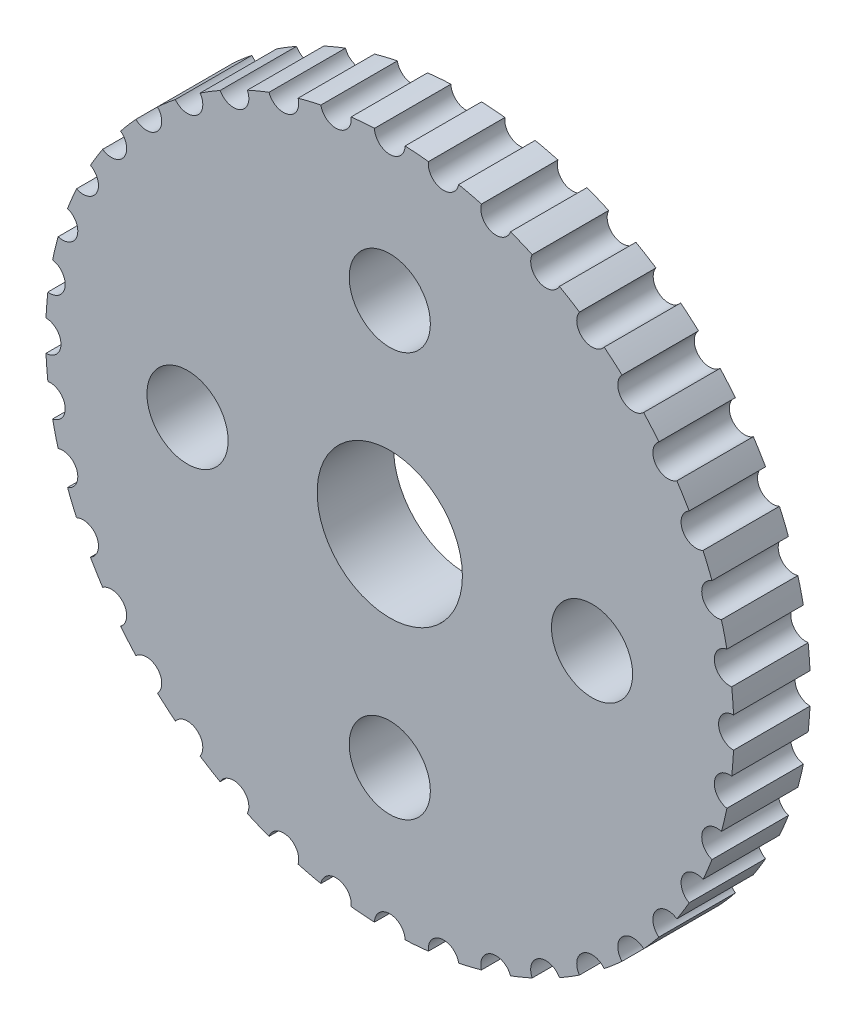
from build123d import *

# Parameters (mm, degrees)
SKETCH_8_R      = 5.308589755
SKETCH_8_R_2    = 9.5
EXTRUDE_1_DEPTH = 10


with BuildPart() as part:
    # 草图8 → 凸台-拉伸1 (new body)
    with BuildSketch(Plane.XY):
        with BuildLine():
            ThreePointArc((44.955555556, -1.999506112), (43, 0), (44.955555556, 1.999506112))
            ThreePointArc((44.955555556, 1.999506112), (44.861280018, 3.530659308), (44.714869736, 5.05770941))
            ThreePointArc((44.714869736, 5.05770941), (42.470598646, 6.726681997), (44.089286398, 9.007487158))
            ThreePointArc((44.089286398, 9.007487158), (43.756646418, 10.505041374), (43.373155424, 11.990387341))
            ThreePointArc((43.373155424, 11.990387341), (40.895430201, 13.287730758), (42.137392686, 15.793673975))
            ThreePointArc((42.137392686, 15.793673975), (41.574578963, 17.220754456), (40.963450077, 18.627822142))
            ThreePointArc((40.963450077, 18.627822142), (38.31328054, 19.521591489), (39.14793652, 22.190968124))
            ThreePointArc((39.14793652, 22.190968124), (38.368807396, 23.512435412), (37.54508864, 24.806578139))
            ThreePointArc((37.54508864, 24.806578139), (34.787730758, 25.274765849), (35.194528232, 28.041846989))
            ThreePointArc((35.194528232, 28.041846989), (34.218268452, 29.225162175), (33.202242516, 30.374513855))
            ThreePointArc((33.202242516, 30.374513855), (30.405591591, 30.405591591), (30.374513855, 33.202242516))
            ThreePointArc((30.374513855, 33.202242516), (29.225162175, 34.218268452), (28.041846989, 35.194528232))
            ThreePointArc((28.041846989, 35.194528232), (25.274765849, 34.787730758), (24.806578139, 37.54508864))
            ThreePointArc((24.806578139, 37.54508864), (23.512435412, 38.368807396), (22.190968124, 39.14793652))
            ThreePointArc((22.190968124, 39.14793652), (19.521591489, 38.31328054), (18.627822142, 40.963450077))
            ThreePointArc((18.627822142, 40.963450077), (17.220754456, 41.574578963), (15.793673975, 42.137392686))
            ThreePointArc((15.793673975, 42.137392686), (13.287730758, 40.895430201), (11.990387341, 43.373155424))
            ThreePointArc((11.990387341, 43.373155424), (10.505041374, 43.756646418), (9.007487158, 44.089286398))
            ThreePointArc((9.007487158, 44.089286398), (6.726681997, 42.470598646), (5.05770941, 44.714869736))
            ThreePointArc((5.05770941, 44.714869736), (3.530659308, 44.861280018), (1.999506112, 44.955555556))
            ThreePointArc((1.999506112, 44.955555556), (0, 43), (-1.999506112, 44.955555556))
            ThreePointArc((-1.999506112, 44.955555556), (-3.530659308, 44.861280018), (-5.05770941, 44.714869736))
            ThreePointArc((-5.05770941, 44.714869736), (-5.044095711, 44.580728744), (-5.039550927, 44.445975327))
            ThreePointArc((-5.039550927, 44.445975327), (-6.860487337, 42.454007398), (-9.007487158, 44.089286398))
            ThreePointArc((-9.007487158, 44.089286398), (-10.505041374, 43.756646418), (-11.990387341, 43.373155424))
            ThreePointArc((-11.990387341, 43.373155424), (-11.927033485, 43.088442863), (-11.905764747, 42.797543233))
            ThreePointArc((-11.905764747, 42.797543233), (-13.570965148, 40.825765044), (-15.793673975, 42.137392686))
            ThreePointArc((-15.793673975, 42.137392686), (-17.220754456, 41.574578963), (-18.627822142, 40.963450077))
            ThreePointArc((-18.627822142, 40.963450077), (-18.479764717, 40.540545937), (-18.429572488, 40.095293588))
            ThreePointArc((-18.429572488, 40.095293588), (-19.941101031, 38.155861807), (-22.190968124, 39.14793652))
            ThreePointArc((-22.190968124, 39.14793652), (-23.512435412, 38.368807396), (-24.806578139, 37.54508864))
            ThreePointArc((-24.806578139, 37.54508864), (-24.541473285, 37.002624685), (-24.450336353, 36.405764747))
            ThreePointArc((-24.450336353, 36.405764747), (-25.811204626, 34.510636615), (-28.041846989, 35.194528232))
            ThreePointArc((-28.041846989, 35.194528232), (-29.225162175, 34.218268452), (-30.374513855, 33.202242516))
            ThreePointArc((-30.374513855, 33.202242516), (-29.963655564, 32.564592842), (-29.819805153, 31.819805153))
            ThreePointArc((-29.819805153, 31.819805153), (-31.033953617, 29.980664767), (-33.202242516, 30.374513855))
            ThreePointArc((-33.202242516, 30.374513855), (-34.218268452, 29.225162175), (-35.194528232, 28.041846989))
            ThreePointArc((-35.194528232, 28.041846989), (-34.613772416, 27.338459928), (-34.405764747, 26.450336353))
            ThreePointArc((-34.405764747, 26.450336353), (-35.478038437, 24.678522623), (-37.54508864, 24.806578139))
            ThreePointArc((-37.54508864, 24.806578139), (-38.368807396, 23.512435412), (-39.14793652, 22.190968124))
            ThreePointArc((-39.14793652, 22.190968124), (-38.378506744, 21.455556373), (-38.095293588, 20.429572488))
            ThreePointArc((-38.095293588, 20.429572488), (-39.031412246, 18.736009236), (-40.963450077, 18.627822142))
            ThreePointArc((-40.963450077, 18.627822142), (-41.574578963, 17.220754456), (-42.137392686, 15.793673975))
            ThreePointArc((-42.137392686, 15.793673975), (-41.166546438, 15.063283409), (-40.797543233, 13.905764747))
            ThreePointArc((-40.797543233, 13.905764747), (-41.604066041, 12.300893353), (-43.373155424, 11.990387341))
            ThreePointArc((-43.373155424, 11.990387341), (-43.756646418, 10.505041374), (-44.089286398, 9.007487158))
            ThreePointArc((-44.089286398, 9.007487158), (-42.910824217, 8.321467879), (-42.445975327, 7.039550927))
            ThreePointArc((-42.445975327, 7.039550927), (-43.130260468, 5.533265957), (-44.714869736, 5.05770941))
            ThreePointArc((-44.714869736, 5.05770941), (-44.861280018, 3.530659308), (-44.955555556, 1.999506112))
            ThreePointArc((-44.955555556, 1.999506112), (-43.570159294, 1.398411798), (-43, 0))
            ThreePointArc((-43, 0), (-43.570159294, -1.398411798), (-44.955555556, -1.999506112))
            ThreePointArc((-44.955555556, -1.999506112), (-44.861280018, -3.530659308), (-44.714869736, -5.05770941))
            ThreePointArc((-44.714869736, -5.05770941), (-43.130260468, -5.533265957), (-42.445975327, -7.039550927))
            ThreePointArc((-42.445975327, -7.039550927), (-42.910824217, -8.321467879), (-44.089286398, -9.007487158))
            ThreePointArc((-44.089286398, -9.007487158), (-43.756646418, -10.505041374), (-43.373155424, -11.990387341))
            ThreePointArc((-43.373155424, -11.990387341), (-41.604066041, -12.300893353), (-40.797543233, -13.905764747))
            ThreePointArc((-40.797543233, -13.905764747), (-41.166546438, -15.063283409), (-42.137392686, -15.793673975))
            ThreePointArc((-42.137392686, -15.793673975), (-41.574578963, -17.220754456), (-40.963450077, -18.627822142))
            ThreePointArc((-40.963450077, -18.627822142), (-39.031412246, -18.736009236), (-38.095293588, -20.429572488))
            ThreePointArc((-38.095293588, -20.429572488), (-38.378506744, -21.455556373), (-39.14793652, -22.190968124))
            ThreePointArc((-39.14793652, -22.190968124), (-38.368807396, -23.512435412), (-37.54508864, -24.806578139))
            ThreePointArc((-37.54508864, -24.806578139), (-35.478038437, -24.678522623), (-34.405764747, -26.450336353))
            ThreePointArc((-34.405764747, -26.450336353), (-34.613772416, -27.338459928), (-35.194528232, -28.041846989))
            ThreePointArc((-35.194528232, -28.041846989), (-34.218268452, -29.225162175), (-33.202242516, -30.374513855))
            ThreePointArc((-33.202242516, -30.374513855), (-31.033953617, -29.980664767), (-29.819805153, -31.819805153))
            ThreePointArc((-29.819805153, -31.819805153), (-29.963655564, -32.564592842), (-30.374513855, -33.202242516))
            ThreePointArc((-30.374513855, -33.202242516), (-29.225162175, -34.218268452), (-28.041846989, -35.194528232))
            ThreePointArc((-28.041846989, -35.194528232), (-25.811204626, -34.510636615), (-24.450336353, -36.405764747))
            ThreePointArc((-24.450336353, -36.405764747), (-24.541473285, -37.002624685), (-24.806578139, -37.54508864))
            ThreePointArc((-24.806578139, -37.54508864), (-23.512435412, -38.368807396), (-22.190968124, -39.14793652))
            ThreePointArc((-22.190968124, -39.14793652), (-19.941101031, -38.155861807), (-18.429572488, -40.095293588))
            ThreePointArc((-18.429572488, -40.095293588), (-18.479764717, -40.540545937), (-18.627822142, -40.963450077))
            ThreePointArc((-18.627822142, -40.963450077), (-17.220754456, -41.574578963), (-15.793673975, -42.137392686))
            ThreePointArc((-15.793673975, -42.137392686), (-13.570965148, -40.825765044), (-11.905764747, -42.797543233))
            ThreePointArc((-11.905764747, -42.797543233), (-11.927033485, -43.088442863), (-11.990387341, -43.373155424))
            ThreePointArc((-11.990387341, -43.373155424), (-10.505041374, -43.756646418), (-9.007487158, -44.089286398))
            ThreePointArc((-9.007487158, -44.089286398), (-6.860487337, -42.454007398), (-5.039550927, -44.445975327))
            ThreePointArc((-5.039550927, -44.445975327), (-5.044095711, -44.580728744), (-5.05770941, -44.714869736))
            ThreePointArc((-5.05770941, -44.714869736), (-3.530659308, -44.861280018), (-1.999506112, -44.955555556))
            ThreePointArc((-1.999506112, -44.955555556), (0, -43), (1.999506112, -44.955555556))
            ThreePointArc((1.999506112, -44.955555556), (3.530659308, -44.861280018), (5.05770941, -44.714869736))
            ThreePointArc((5.05770941, -44.714869736), (6.726681997, -42.470598646), (9.007487158, -44.089286398))
            ThreePointArc((9.007487158, -44.089286398), (10.505041374, -43.756646418), (11.990387341, -43.373155424))
            ThreePointArc((11.990387341, -43.373155424), (13.287730758, -40.895430201), (15.793673975, -42.137392686))
            ThreePointArc((15.793673975, -42.137392686), (17.220754456, -41.574578963), (18.627822142, -40.963450077))
            ThreePointArc((18.627822142, -40.963450077), (19.521591489, -38.31328054), (22.190968124, -39.14793652))
            ThreePointArc((22.190968124, -39.14793652), (23.512435412, -38.368807396), (24.806578139, -37.54508864))
            ThreePointArc((24.806578139, -37.54508864), (25.274765849, -34.787730758), (28.041846989, -35.194528232))
            ThreePointArc((28.041846989, -35.194528232), (29.225162175, -34.218268452), (30.374513855, -33.202242516))
            ThreePointArc((30.374513855, -33.202242516), (30.405591591, -30.405591591), (33.202242516, -30.374513855))
            ThreePointArc((33.202242516, -30.374513855), (34.218268452, -29.225162175), (35.194528232, -28.041846989))
            ThreePointArc((35.194528232, -28.041846989), (34.787730758, -25.274765849), (37.54508864, -24.806578139))
            ThreePointArc((37.54508864, -24.806578139), (38.368807396, -23.512435412), (39.14793652, -22.190968124))
            ThreePointArc((39.14793652, -22.190968124), (38.31328054, -19.521591489), (40.963450077, -18.627822142))
            ThreePointArc((40.963450077, -18.627822142), (41.574578963, -17.220754456), (42.137392686, -15.793673975))
            ThreePointArc((42.137392686, -15.793673975), (40.895430201, -13.287730758), (43.373155424, -11.990387341))
            ThreePointArc((43.373155424, -11.990387341), (43.756646418, -10.505041374), (44.089286398, -9.007487158))
            ThreePointArc((44.089286398, -9.007487158), (42.470598646, -6.726681997), (44.714869736, -5.05770941))
            ThreePointArc((44.714869736, -5.05770941), (44.861280018, -3.530659308), (44.955555556, -1.999506112))
        make_face()
        with Locations((0, -26.450336353)):
            Circle(SKETCH_8_R, mode=Mode.SUBTRACT)
        with Locations((-26.450336353, 0)):
            Circle(SKETCH_8_R, mode=Mode.SUBTRACT)
        Circle(SKETCH_8_R_2, mode=Mode.SUBTRACT)
        with Locations((0, 26.450336353)):
            Circle(SKETCH_8_R, mode=Mode.SUBTRACT)
        with Locations((26.450336353, 0)):
            Circle(SKETCH_8_R, mode=Mode.SUBTRACT)
    extrude(amount=EXTRUDE_1_DEPTH)


solid = part.part
